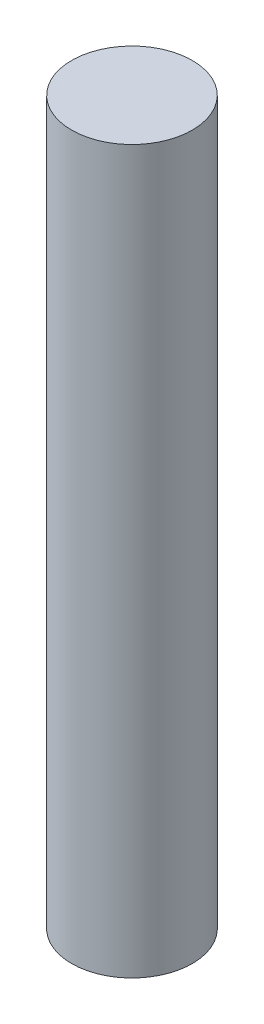
from build123d import *

# Parameters (mm, degrees)
SKETCH1_R           = 2.065
BOSS_EXTRUDE1_DEPTH = 24.7


with BuildPart() as part:
    # Sketch1 → Boss-Extrude1 (new body)
    with BuildSketch(Plane(origin=(0, 0, 0), x_dir=(1, 0, 0), z_dir=(0, 1, 0))):
        Circle(SKETCH1_R)
    extrude(amount=BOSS_EXTRUDE1_DEPTH)


solid = part.part
